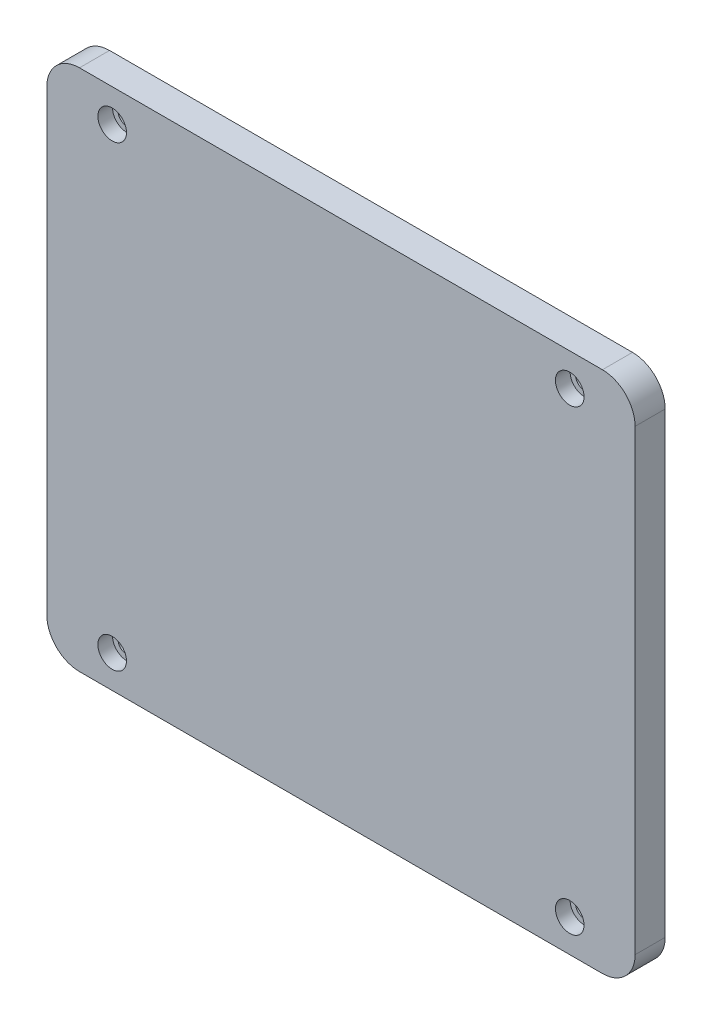
from build123d import *

# Parameters (mm, degrees)
SKETCH1_W                                      = 114.3
SKETCH1_H                                      = 101.6
BOSS_EXTRUDE1_DEPTH                            = 5.842
CBORE_FOR_4_SOCKET_HEAD_CAP_SCREW1_D           = 3.4544
CBORE_FOR_4_SOCKET_HEAD_CAP_SCREW1_CBORE_D     = 5.55752
CBORE_FOR_4_SOCKET_HEAD_CAP_SCREW1_CBORE_DEPTH = 2.8448
FILLET1_R                                      = 6.35


with BuildPart() as part:
    # Sketch1 → Boss-Extrude1 (new body)
    with BuildSketch(Plane.XY):
        Rectangle(SKETCH1_W, SKETCH1_H)
    extrude(amount=BOSS_EXTRUDE1_DEPTH)

    # CBORE for #4 Socket Head Cap Screw1 (through all)
    with Locations(Plane.XY.offset(5.842)):
        with Locations((-44.45, 44.45), (-44.45, -44.45), (44.45, -44.45), (44.45, 44.45)):
            CounterBoreHole(CBORE_FOR_4_SOCKET_HEAD_CAP_SCREW1_D / 2, CBORE_FOR_4_SOCKET_HEAD_CAP_SCREW1_CBORE_D / 2, CBORE_FOR_4_SOCKET_HEAD_CAP_SCREW1_CBORE_DEPTH)

    # Fillet1
    fillet1_edges = [part.edges().sort_by_distance(p)[0] for p in [
        (57.15, -50.8, 2.921),
        (-57.15, -50.8, 2.921),
        (-57.15, 50.8, 2.921),
        (57.15, 50.8, 2.921),
    ]]
    fillet(fillet1_edges, radius=FILLET1_R)


solid = part.part
